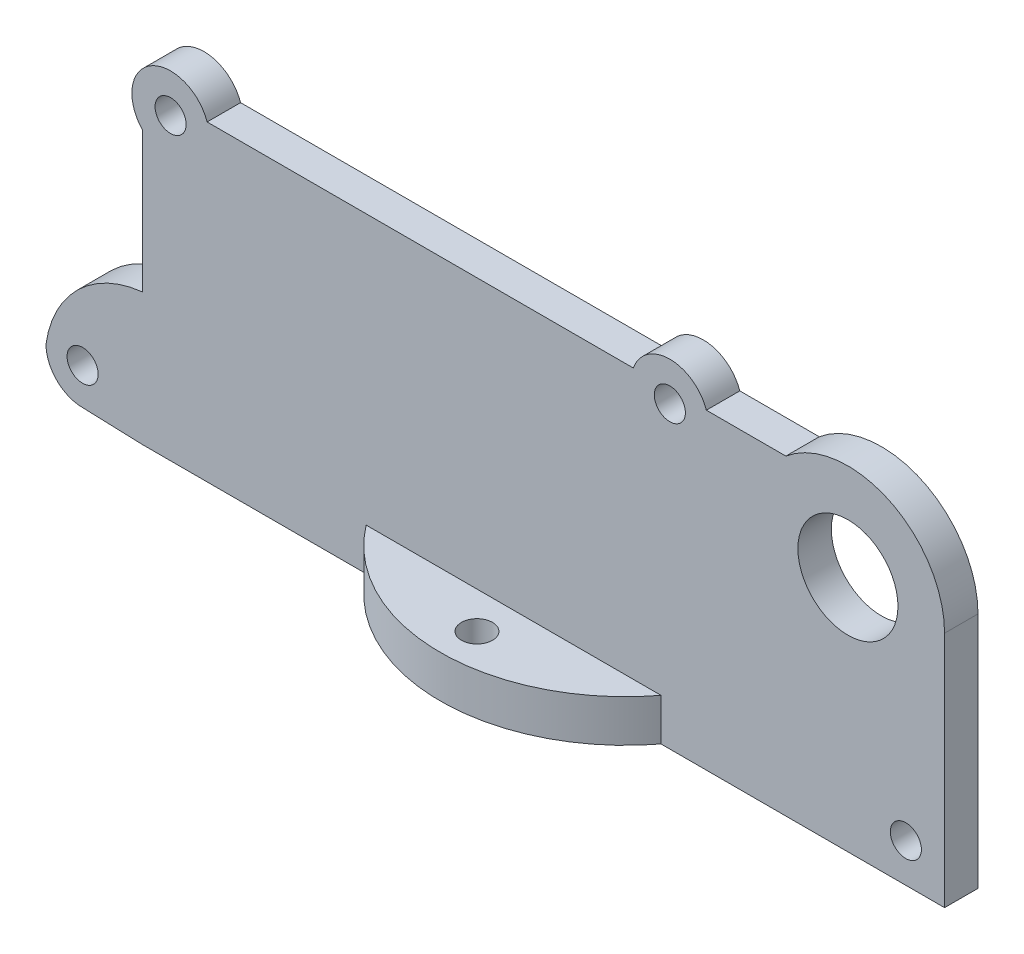
from build123d import *

# Parameters (mm, degrees)
SKETCH1_W            = 6.266
SKETCH1_H            = 19.6
SKETCH1_R            = 1.675
SKETCH1_W_2          = 52.832
SKETCH1_H_2          = 5
BOSS_EXTRUDE2_DEPTH  = 3.175
SKETCH3_W            = 30
SKETCH3_H            = 29.6
BOSS_EXTRUDE3_DEPTH  = 3.175
SKETCH4_R            = 4.75
CUT_EXTRUDE1_DEPTH   = 10
BOSS_EXTRUDE14_DEPTH = 3.175
CUT_EXTRUDE8_DEPTH   = 10
SKETCH24_R           = 1.475
CUT_EXTRUDE9_DEPTH   = 10
SKETCH25_R           = 3.675
SKETCH25_R_2         = 1.675
BOSS_EXTRUDE15_DEPTH = 3.175
SKETCH26_R           = 1.475
CUT_EXTRUDE12_DEPTH  = 3.175
CUT_EXTRUDE13_DEPTH  = 10
SKETCH28_R           = 3.675
SKETCH28_R_2         = 1.675
BOSS_EXTRUDE16_DEPTH = 3.175
SKETCH29_R           = 1.475
BOSS_EXTRUDE17_DEPTH = 3.175
SKETCH30_W           = 52.236337303
SKETCH30_H           = 21.491937942
BOSS_EXTRUDE18_DEPTH = 3.175
CUT_EXTRUDE14_DEPTH  = 10
SKETCH32_R           = 1.475
BOSS_EXTRUDE19_DEPTH = 4
SKETCH33_R           = 2.220955703
SKETCH33_R_2         = 1.475
SKETCH33_R_3         = 2.214708119
BOSS_EXTRUDE20_DEPTH = 3.175
SKETCH34_R           = 1.475
BOSS_EXTRUDE21_DEPTH = 4


with BuildPart() as part:
    # Sketch1 → Boss-Extrude2 (new body)
    # profile 1 of 4: a face of its own
    with BuildSketch(Plane.XY):
        with Locations((-23.283, 0)):
            Rectangle(SKETCH1_W, SKETCH1_H)
        with Locations((-23.95, -4.974)):
            Circle(SKETCH1_R, mode=Mode.SUBTRACT)
        with Locations((-23.95, 4.974)):
            Circle(SKETCH1_R, mode=Mode.SUBTRACT)
    # profile 2 of 4: a face of its own
    with BuildSketch(Plane.XY):
        with Locations((0, -12.3)):
            Rectangle(SKETCH1_W_2, SKETCH1_H_2)
    # profile 3 of 4: a face of its own
    with BuildSketch(Plane.XY):
        with Locations((0, 12.3)):
            Rectangle(SKETCH1_W_2, SKETCH1_H_2)
    # profile 4 of 4: a face of its own
    with BuildSketch(Plane.XY):
        with Locations((23.283, 0)):
            Rectangle(SKETCH1_W, SKETCH1_H)
        with Locations((23.95, -4.974)):
            Circle(SKETCH1_R, mode=Mode.SUBTRACT)
        with Locations((23.95, 4.974)):
            Circle(SKETCH1_R, mode=Mode.SUBTRACT)
    extrude(amount=BOSS_EXTRUDE2_DEPTH)

    # Sketch3 → Boss-Extrude3 (add)
    with BuildSketch(Plane.XY.offset(3.175)):
        with Locations((41.416, 0)):
            Rectangle(SKETCH3_W, SKETCH3_H)
    extrude(amount=-BOSS_EXTRUDE3_DEPTH)

    # Sketch4 → Cut-Extrude1 (cut)
    with BuildSketch(Plane(origin=(0, 0, 0), x_dir=(-1, 0, 0), z_dir=(0, 0, -1))):
        with Locations((-40.576, 7.77)):
            Circle(SKETCH4_R)
    extrude(amount=-CUT_EXTRUDE1_DEPTH, mode=Mode.SUBTRACT)

    # Sketch22 → Boss-Extrude14 (add)
    with BuildSketch(Plane(origin=(0, 0, 0), x_dir=(-1, 0, 0), z_dir=(0, 0, -1))):
        with BuildLine():
            ThreePointArc((-34.680262133, 14.8), (-40.576, 16.945), (-46.471737867, 14.8))
            Line((-46.471737867, 14.8), (-34.680262133, 14.8))
        make_face()
    extrude(amount=-BOSS_EXTRUDE14_DEPTH)

    # Sketch23 → Cut-Extrude8 (cut)
    with BuildSketch(Plane(origin=(0, 0, 0), x_dir=(-1, 0, 0), z_dir=(0, 0, -1))):
        with BuildLine():
            Line((-49.751, -14.8), (-49.751, 7.77))
            ThreePointArc((-49.751, 7.77), (-48.890866804, 11.648609936), (-46.471737867, 14.8))
            Line((-46.471737867, 14.8), (-56.416, 14.8))
            Line((-56.416, 14.8), (-56.416, -14.8))
            Line((-56.416, -14.8), (-49.751, -14.8))
        make_face()
    extrude(amount=-CUT_EXTRUDE8_DEPTH, mode=Mode.SUBTRACT)

    # Sketch24 → Cut-Extrude9 (cut)
    with BuildSketch(Plane(origin=(0, 0, 0), x_dir=(-1, 0, 0), z_dir=(0, 0, -1))):
        with Locations((23.736, 13.59)):
            Circle(SKETCH24_R)
    extrude(amount=-CUT_EXTRUDE9_DEPTH, mode=Mode.SUBTRACT)

    # Sketch25 → Boss-Extrude15 (add)
    # profile 1 of 3: a face of its own
    with BuildSketch(Plane(origin=(0, 0, 0), x_dir=(-1, 0, 0), z_dir=(0, 0, -1))):
        with Locations((23.95, -4.974)):
            Circle(SKETCH25_R)
        with Locations(Location((23.95, -4.974, 0), (0, 0, 180))):
            Circle(SKETCH25_R_2, mode=Mode.SUBTRACT)
    # profile 2 of 3: a face of its own
    with BuildSketch(Plane(origin=(0, 0, 0), x_dir=(-1, 0, 0), z_dir=(0, 0, -1))):
        with Locations((23.95, 4.974)):
            Circle(SKETCH25_R)
        with Locations(Location((23.95, 4.974, 0), (0, 0, 180))):
            Circle(SKETCH25_R_2, mode=Mode.SUBTRACT)
    # profile 3 of 3: a face of its own
    with BuildSketch(Plane(origin=(0, 0, 0), x_dir=(-1, 0, 0), z_dir=(0, 0, -1))):
        with Locations((23.736, 13.59)):
            Circle(SKETCH25_R)
        with Locations((23.736, 13.59)):
            Circle(SKETCH25_R_2, mode=Mode.SUBTRACT)
    extrude(amount=-BOSS_EXTRUDE15_DEPTH)

    # Sketch26 → Cut-Extrude12 (cut)
    with BuildSketch(Plane(origin=(0, 0, 0), x_dir=(-1, 0, 0), z_dir=(0, 0, -1))):
        with Locations((-46.076, -11.125)):
            Circle(SKETCH26_R)
    extrude(amount=-CUT_EXTRUDE12_DEPTH, mode=Mode.SUBTRACT)

    # Sketch27 → Cut-Extrude13 (cut)
    with BuildSketch(Plane(origin=(0, 0, 0), x_dir=(-1, 0, 0), z_dir=(0, 0, -1))):
        with BuildLine():
            ThreePointArc((-22.190754209, 13.59), (-22.358119678, 14.272434563), (-22.822234796, 14.8))
            Line((-22.822234796, 14.8), (-24.509273622, 14.8))
            ThreePointArc((-24.509273622, 14.8), (-24.348188772, 12.282365469), (-22.190754209, 13.59))
        make_face()
        with BuildLine():
            Line((-24.509273622, 14.8), (-22.822234796, 14.8))
            ThreePointArc((-22.822234796, 14.8), (-23.665754209, 15.065), (-24.509273622, 14.8))
        make_face()
    extrude(amount=-CUT_EXTRUDE13_DEPTH, mode=Mode.SUBTRACT)

    # Sketch28 → Boss-Extrude16 (add)
    with BuildSketch(Plane(origin=(0, 0, 0), x_dir=(-1, 0, 0), z_dir=(0, 0, -1))):
        with Locations((-23.665754209, 13.59)):
            Circle(SKETCH28_R)
        with Locations((-23.665754209, 13.59)):
            Circle(SKETCH28_R_2, mode=Mode.SUBTRACT)
    extrude(amount=-BOSS_EXTRUDE16_DEPTH)

    # Sketch29 → Boss-Extrude17 (add)
    with BuildSketch(Plane(origin=(0, 0, 0), x_dir=(-1, 0, 0), z_dir=(0, 0, -1))):
        with BuildLine():
            ThreePointArc((35.566, -11.125), (32.517318638, -5.113632727), (26.416, -2.249212118))
            Line((26.416, -2.249212118), (26.416, -14.8))
            Line((26.416, -14.8), (32.091, -14.6))
            ThreePointArc((32.091, -14.6), (34.548196065, -13.582196065), (35.566, -11.125))
        make_face()
        with Locations((32.091, -11.125)):
            Circle(SKETCH29_R, mode=Mode.SUBTRACT)
    extrude(amount=-BOSS_EXTRUDE17_DEPTH)

    # Sketch30 → Boss-Extrude18 (add)
    with BuildSketch(Plane(origin=(0, 0, 0), x_dir=(-1, 0, 0), z_dir=(0, 0, -1))):
        with Locations((-0.180648482, 0.066835569)):
            Rectangle(SKETCH30_W, SKETCH30_H)
    extrude(amount=-BOSS_EXTRUDE18_DEPTH)

    # Sketch31 → Cut-Extrude14 (cut)
    with BuildSketch(Plane(origin=(0, 0, 0), x_dir=(-1, 0, 0), z_dir=(0, 0, -1))):
        Polygon((26.416, 9.86570219), (26.416, 0.686094798), (31.474426215, 3.163131713), align=None)
    extrude(amount=-CUT_EXTRUDE14_DEPTH, mode=Mode.SUBTRACT)

    # Sketch32 → Boss-Extrude19 (add)
    with BuildSketch(Plane(origin=(0, -14.8, 0), x_dir=(-1, 0, 0), z_dir=(0, -1, 0))):
        with BuildLine():
            ThreePointArc((-22.83, -3.175), (-16.387108849, -7.772233652), (-8.83, -10.125))
            ThreePointArc((-8.83, -10.125), (-1.272891151, -7.772233652), (5.17, -3.175))
            Line((5.17, -3.175), (-22.83, -3.175))
        make_face()
        with Locations(Location((-8.83, -6.65, 0), (0, 0, 180))):
            Circle(SKETCH32_R, mode=Mode.SUBTRACT)
    extrude(amount=-BOSS_EXTRUDE19_DEPTH)

    # Sketch33 → Boss-Extrude20 (add)
    # profile 1 of 2: a face of its own
    with BuildSketch(Plane(origin=(0, 0, 0), x_dir=(-1, 0, 0), z_dir=(0, 0, -1))):
        with Locations((-23.665754209, 13.59)):
            Circle(SKETCH33_R)
        with Locations((-23.665754209, 13.59)):
            Circle(SKETCH33_R_2, mode=Mode.SUBTRACT)
    # profile 2 of 2: a face of its own
    with BuildSketch(Plane(origin=(0, 0, 0), x_dir=(-1, 0, 0), z_dir=(0, 0, -1))):
        with Locations((23.736, 13.59)):
            Circle(SKETCH33_R_3)
        with Locations((23.736, 13.59)):
            Circle(SKETCH33_R_2, mode=Mode.SUBTRACT)
    extrude(amount=-BOSS_EXTRUDE20_DEPTH)

    # Sketch34 → Boss-Extrude21 (add)
    with BuildSketch(Plane(origin=(0, -14.8, 0), x_dir=(-1, 0, 0), z_dir=(0, -1, 0))):
        with BuildLine():
            Line((5.17, -3.175), (-22.83, -3.175))
            ThreePointArc((-22.83, -3.175), (-8.83, -10.125), (5.17, -3.175))
        make_face()
        with Locations(Location((-8.83, -6.65, 0), (0, 0, 180))):
            Circle(SKETCH34_R, mode=Mode.SUBTRACT)
    extrude(amount=-BOSS_EXTRUDE21_DEPTH)


solid = part.part
